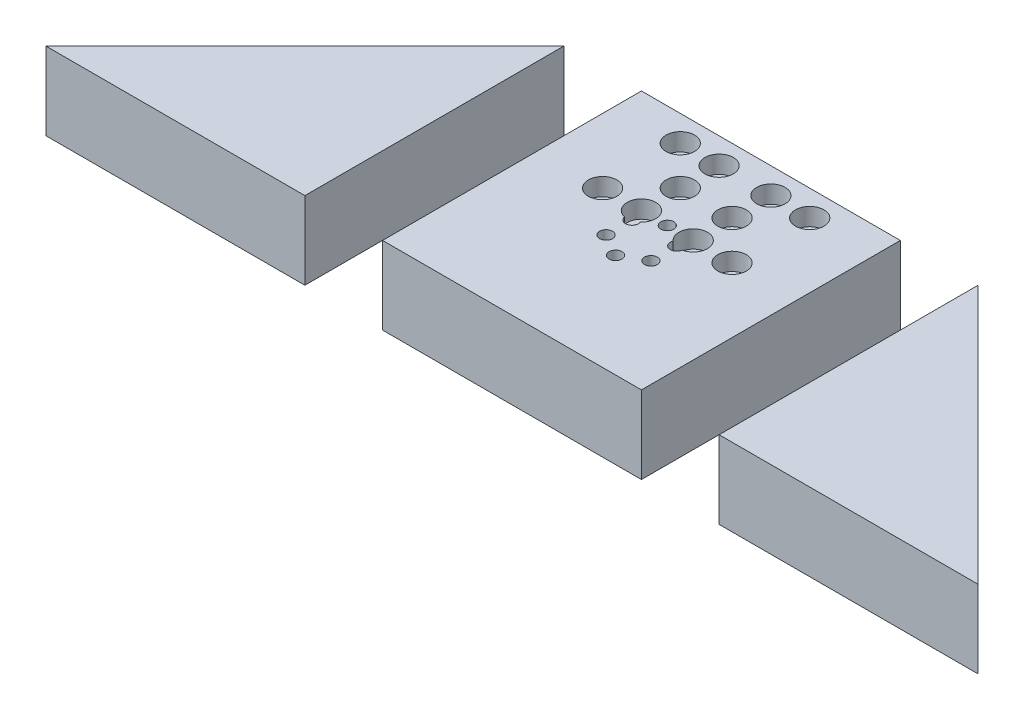
from build123d import *

# Parameters (mm, degrees)
EXTRUDE_1_DEPTH             = 30
SKETCH_1_W                  = 100
SKETCH_1_H                  = 100
EXTRUDE_1_2_DEPTH           = 30
SKETCH_5_W                  = 2.5
SKETCH_5_H                  = 30
PATTERN_LINEAR_1_COUNT      = 2
PATTERN_LINEAR_1_PITCH      = 15
PATTERN_LINEAR_1_COUNT_DIR2 = 3
PATTERN_LINEAR_1_PITCH_DIR2 = 15
PATTERN_CIRCULAR_1_COUNT    = 6


with BuildPart() as part:
    # 草图1 → 凸台-拉伸1 (new body)
    with BuildSketch(Plane(origin=(0, 0, 0), x_dir=(1, 0, 0), z_dir=(0, 1, 0))):
        Polygon((80, 50), (80, -50), (180, -50), align=None)
    extrude(amount=EXTRUDE_1_DEPTH)


with BuildPart() as body_2:
    # 草图1 → Extrude 1 2 (new body)
    with BuildSketch(Plane(origin=(0, 0, 0), x_dir=(1, 0, 0), z_dir=(0, 1, 0))):
        Rectangle(SKETCH_1_W, SKETCH_1_H)
    extrude(amount=EXTRUDE_1_2_DEPTH)

    # 草图3 → Hole Wizard M6 _1 (revolve, cut)
    with BuildSketch(Plane(origin=(-25, 30, -10), x_dir=(0, 0, 1), z_dir=(1, 0, 0))):
        Polygon((0, 0), (0, 30), (3.3, 30), (3.3, 6.8), (5.5, 6.8), (5.5, 0), align=None)
    hole_wizard_m6_1 = revolve(axis=Axis((-25, 36.35, -10), (0, -1, 0)), mode=Mode.SUBTRACT)

    # 草图5 → Hole Wizard M6 _1 2 (revolve, cut)
    with BuildSketch(Plane(origin=(0, 30, -10), x_dir=(0, 0, 1), z_dir=(1, 0, 0))):
        with Locations((1.25, 15)):
            Rectangle(SKETCH_5_W, SKETCH_5_H)
    hole_wizard_m6_1_2 = revolve(axis=Axis((0, 36.35, -10), (0, -1, 0)), mode=Mode.SUBTRACT)

    # 阵列(线性)1: Hole Wizard M6 _1 2 × 3, 1 skipped
    with Locations(*[(i * PATTERN_LINEAR_1_PITCH, 0, -j * PATTERN_LINEAR_1_PITCH_DIR2) for i in range(PATTERN_LINEAR_1_COUNT) for j in range(PATTERN_LINEAR_1_COUNT_DIR2) if (i, j) not in ((0, 0), (0, 1))]):
        add(hole_wizard_m6_1, mode=Mode.SUBTRACT)

    # 阵列(圆周)1: Hole Wizard M6 _1 2 ×6 about axis
    pattern_circular_1_axis = Axis((0, 0, 0), (0, 1, 0))
    for i in range(1, PATTERN_CIRCULAR_1_COUNT):
        add(hole_wizard_m6_1_2.rotate(pattern_circular_1_axis, i * 360 / PATTERN_CIRCULAR_1_COUNT), mode=Mode.SUBTRACT)

    # 镜向1 copy 1 sketch → 镜向1 copy 1 (revolve, cut)
    with BuildSketch(Plane(origin=(25, 30, -40), x_dir=(0, 0, 1), z_dir=(-1, 0, 0))):
        Polygon((0, 0), (0, -30), (3.3, -30), (3.3, -6.8), (5.5, -6.8), (5.5, 0), align=None)
    revolve(axis=Axis((25, 36.35, -40), (0, 1, 0)), mode=Mode.SUBTRACT)

    # 镜向1 copy 2 sketch → 镜向1 copy 2 (revolve, cut)
    with BuildSketch(Plane(origin=(10, 30, -10), x_dir=(0, 0, 1), z_dir=(-1, 0, 0))):
        Polygon((0, 0), (0, -30), (3.3, -30), (3.3, -6.8), (5.5, -6.8), (5.5, 0), align=None)
    revolve(axis=Axis((10, 36.35, -10), (0, 1, 0)), mode=Mode.SUBTRACT)

    # 镜向1 copy 3 sketch → 镜向1 copy 3 (revolve, cut)
    with BuildSketch(Plane(origin=(10, 30, -25), x_dir=(0, 0, 1), z_dir=(-1, 0, 0))):
        Polygon((0, 0), (0, -30), (3.3, -30), (3.3, -6.8), (5.5, -6.8), (5.5, 0), align=None)
    revolve(axis=Axis((10, 36.35, -25), (0, 1, 0)), mode=Mode.SUBTRACT)

    # 镜向1 copy 4 sketch → 镜向1 copy 4 (revolve, cut)
    with BuildSketch(Plane(origin=(10, 30, -40), x_dir=(0, 0, 1), z_dir=(-1, 0, 0))):
        Polygon((0, 0), (0, -30), (3.3, -30), (3.3, -6.8), (5.5, -6.8), (5.5, 0), align=None)
    revolve(axis=Axis((10, 36.35, -40), (0, 1, 0)), mode=Mode.SUBTRACT)

    # 镜向1 copy 5 sketch → 镜向1 copy 5 (revolve, cut)
    with BuildSketch(Plane(origin=(25, 30, -10), x_dir=(0, 0, 1), z_dir=(-1, 0, 0))):
        Polygon((0, 0), (0, -30), (3.3, -30), (3.3, -6.8), (5.5, -6.8), (5.5, 0), align=None)
    revolve(axis=Axis((25, 36.35, -10), (0, 1, 0)), mode=Mode.SUBTRACT)


with BuildPart() as body_3:
    # 镜向3: mirrored copy
    add(part.part.mirror(Plane(origin=(0, 0, 0), x_dir=(0, 0, 1), z_dir=(1, 0, 0))))


solid = Compound([part.part, body_2.part, body_3.part])
